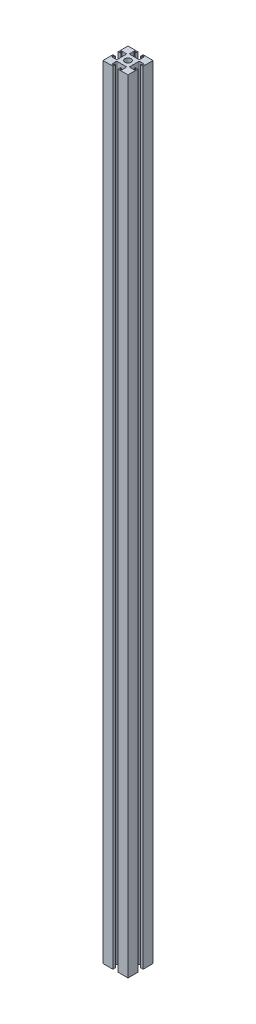
from build123d import *

# Parameters (mm, degrees)
RESSALTO_EXTRUS_O1_DEPTH = 1250
ESBO_O2_3_R              = 5
CORTE_EXTRUS_O1_DEPTH    = 10
CORTE_EXTRUS_O2_START    = -20
ESBO_O4_R                = 5
CORTE_EXTRUS_O2_DEPTH    = 20


with BuildPart() as part:
    # Esboço2 → Ressalto-extrusão1 (new body)
    with BuildSketch(Plane(origin=(0, 0, 0), x_dir=(1, 0, 0), z_dir=(0, 1, 0))):
        with BuildLine():
            Line((-1.803730261, 22.417940287), (-1.803730261, 6.567940287))
            Line((-1.803730261, 6.567940287), (2.696269739, 6.567940287))
            Line((2.696269739, 6.567940287), (2.696269739, 7.917940287))
            Line((2.696269739, 7.917940287), (-0.281184469, 7.917940287))
            Line((-0.281184469, 7.917940287), (-0.281184469, 9.417940287))
            ThreePointArc((-0.281184469, 9.417940287), (0.01170875, 10.125047068), (0.718815531, 10.417940287))
            Line((0.718815531, 10.417940287), (7.218815531, 10.417940287))
            ThreePointArc((7.218815531, 10.417940287), (7.925922312, 10.125047068), (8.218815531, 9.417940287))
            Line((8.218815531, 9.417940287), (8.218815531, -4.582059713))
            ThreePointArc((8.218815531, -4.582059713), (7.925922312, -5.289166494), (7.218815531, -5.582059713))
            Line((7.218815531, -5.582059713), (0.718815531, -5.582059713))
            ThreePointArc((0.718815531, -5.582059713), (0.01170875, -5.289166494), (-0.281184469, -4.582059713))
            Line((-0.281184469, -4.582059713), (-0.281184469, -3.082059713))
            Line((-0.281184469, -3.082059713), (2.696269739, -3.082059713))
            Line((2.696269739, -3.082059713), (2.696269739, -1.732059713))
            Line((2.696269739, -1.732059713), (-1.803730261, -1.732059713))
            Line((-1.803730261, -1.732059713), (-1.803730261, -17.582059713))
            Line((-1.803730261, -17.582059713), (14.046269739, -17.582059713))
            Line((14.046269739, -17.582059713), (14.046269739, -13.082059713))
            Line((14.046269739, -13.082059713), (12.696269739, -13.082059713))
            Line((12.696269739, -13.082059713), (12.696269739, -16.059513921))
            Line((12.696269739, -16.059513921), (11.196269739, -16.059513921))
            ThreePointArc((11.196269739, -16.059513921), (10.489162958, -15.766620702), (10.196269739, -15.059513921))
            Line((10.196269739, -15.059513921), (10.196269739, -8.559513921))
            ThreePointArc((10.196269739, -8.559513921), (10.489162958, -7.85240714), (11.196269739, -7.559513921))
            Line((11.196269739, -7.559513921), (25.196269739, -7.559513921))
            ThreePointArc((25.196269739, -7.559513921), (25.90337652, -7.85240714), (26.196269739, -8.559513921))
            Line((26.196269739, -8.559513921), (26.196269739, -15.059513921))
            ThreePointArc((26.196269739, -15.059513921), (25.90337652, -15.766620702), (25.196269739, -16.059513921))
            Line((25.196269739, -16.059513921), (23.696269739, -16.059513921))
            Line((23.696269739, -16.059513921), (23.696269739, -13.082059713))
            Line((23.696269739, -13.082059713), (22.346269739, -13.082059713))
            Line((22.346269739, -13.082059713), (22.346269739, -17.582059713))
            Line((22.346269739, -17.582059713), (38.196269739, -17.582059713))
            Line((38.196269739, -17.582059713), (38.196269739, -1.732059713))
            Line((38.196269739, -1.732059713), (33.696269739, -1.732059713))
            Line((33.696269739, -1.732059713), (33.696269739, -3.082059713))
            Line((33.696269739, -3.082059713), (36.673723947, -3.082059713))
            Line((36.673723947, -3.082059713), (36.673723947, -4.582059713))
            ThreePointArc((36.673723947, -4.582059713), (36.380830728, -5.289166494), (35.673723947, -5.582059713))
            Line((35.673723947, -5.582059713), (29.173723947, -5.582059713))
            ThreePointArc((29.173723947, -5.582059713), (28.466617166, -5.289166494), (28.173723947, -4.582059713))
            Line((28.173723947, -4.582059713), (28.173723947, 9.417940287))
            ThreePointArc((28.173723947, 9.417940287), (28.466617166, 10.125047068), (29.173723947, 10.417940287))
            Line((29.173723947, 10.417940287), (35.673723947, 10.417940287))
            ThreePointArc((35.673723947, 10.417940287), (36.380830728, 10.125047068), (36.673723947, 9.417940287))
            Line((36.673723947, 9.417940287), (36.673723947, 7.917940287))
            Line((36.673723947, 7.917940287), (33.696269739, 7.917940287))
            Line((33.696269739, 7.917940287), (33.696269739, 6.567940287))
            Line((33.696269739, 6.567940287), (38.196269739, 6.567940287))
            Line((38.196269739, 6.567940287), (38.196269739, 22.417940287))
            Line((38.196269739, 22.417940287), (22.346269739, 22.417940287))
            Line((22.346269739, 22.417940287), (22.346269739, 17.917940287))
            Line((22.346269739, 17.917940287), (23.696269739, 17.917940287))
            Line((23.696269739, 17.917940287), (23.696269739, 20.895394495))
            Line((23.696269739, 20.895394495), (25.196269739, 20.895394495))
            ThreePointArc((25.196269739, 20.895394495), (25.90337652, 20.602501277), (26.196269739, 19.895394495))
            Line((26.196269739, 19.895394495), (26.196269739, 13.395394495))
            ThreePointArc((26.196269739, 13.395394495), (25.90337652, 12.688287714), (25.196269739, 12.395394495))
            Line((25.196269739, 12.395394495), (11.196269739, 12.395394495))
            ThreePointArc((11.196269739, 12.395394495), (10.489162958, 12.688287714), (10.196269739, 13.395394495))
            Line((10.196269739, 13.395394495), (10.196269739, 19.895394495))
            ThreePointArc((10.196269739, 19.895394495), (10.489162958, 20.602501277), (11.196269739, 20.895394495))
            Line((11.196269739, 20.895394495), (12.696269739, 20.895394495))
            Line((12.696269739, 20.895394495), (12.696269739, 17.917940287))
            Line((12.696269739, 17.917940287), (14.046269739, 17.917940287))
            Line((14.046269739, 17.917940287), (14.046269739, 22.417940287))
            Line((14.046269739, 22.417940287), (-1.803730261, 22.417940287))
        make_face()
    extrude(amount=RESSALTO_EXTRUS_O1_DEPTH)

    # Esboço2<3> → Corte-extrusão1 (cut)
    with BuildSketch(Plane(origin=(0, 0, 0), x_dir=(1, 0, 0), z_dir=(0, 1, 0))):
        with Locations((18.196269739, 2.417940287)):
            Circle(ESBO_O2_3_R)
    extrude(amount=CORTE_EXTRUS_O1_DEPTH, mode=Mode.SUBTRACT)

    # Esboço4 → Corte-extrusão2 (cut)
    with BuildSketch(Plane(origin=(0, 1250, 0), x_dir=(1, 0, 0), z_dir=(0, 1, 0)).offset(CORTE_EXTRUS_O2_START)):
        with Locations((18.196269739, 2.417940287)):
            Circle(ESBO_O4_R)
    extrude(amount=CORTE_EXTRUS_O2_DEPTH, mode=Mode.SUBTRACT)


solid = part.part
